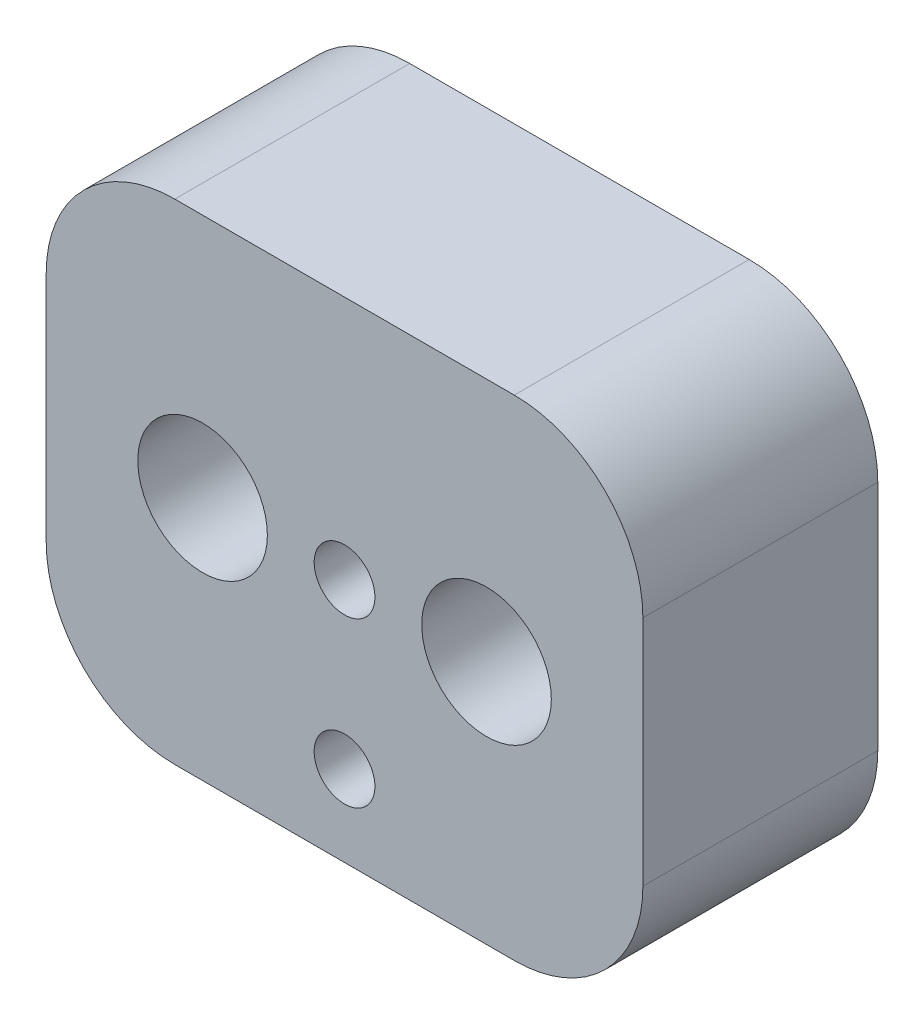
from build123d import *

# Parameters (mm, degrees)
SKETCH1_W                = 14.732
SKETCH1_H                = 12.0904
BOSS_EXTRUDE1_DEPTH      = 5.8
SKETCH2_R                = 0.75
CUT_EXTRUDE1_DEPTH       = 5.8
M3_CLEARANCE_HOLE1_D     = 3.2
M3_CLEARANCE_HOLE1_DEPTH = 36.28
M3_CLEARANCE_HOLE1_TIP   = 0.96137699
FILLET1_R                = 3.175


with BuildPart() as part:
    # Sketch1 → Boss-Extrude1 (new body)
    with BuildSketch(Plane.XY):
        with Locations((7.366, 6.0452)):
            Rectangle(SKETCH1_W, SKETCH1_H)
    extrude(amount=BOSS_EXTRUDE1_DEPTH)

    # Sketch2 → Cut-Extrude1 (cut)
    with BuildSketch(Plane.XY.offset(5.8)):
        with Locations((7.366, 6.0452)):
            Circle(SKETCH2_R)
        with Locations((7.366, 2)):
            Circle(SKETCH2_R)
    extrude(amount=-CUT_EXTRUDE1_DEPTH, mode=Mode.SUBTRACT)

    # M3 Clearance Hole1
    with Locations(Plane.XY.offset(5.8)):
        with Locations((3.8608, 6.0452), (10.8712, 6.0452)):
            Hole(M3_CLEARANCE_HOLE1_D / 2, depth=M3_CLEARANCE_HOLE1_DEPTH)
            with Locations((0, 0, -(M3_CLEARANCE_HOLE1_DEPTH + M3_CLEARANCE_HOLE1_TIP / 2))):  # 118° drill point
                Cone(0, M3_CLEARANCE_HOLE1_D / 2, M3_CLEARANCE_HOLE1_TIP, mode=Mode.SUBTRACT)

    # Fillet1
    fillet1_edges = [part.edges().sort_by_distance(p)[0] for p in [
        (0, 12.0904, 2.9),
        (14.732, 12.0904, 2.9),
        (14.732, 0, 2.9),
        (0, 0, 2.9),
    ]]
    fillet(fillet1_edges, radius=FILLET1_R)


solid = part.part
